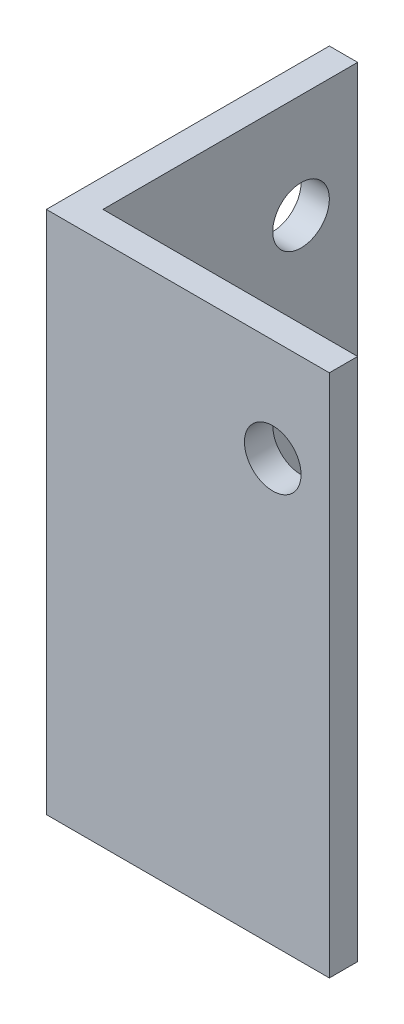
from build123d import *

# Parameters (mm, degrees)
BOSS_EXTRUDE1_DEPTH = 21
SKETCH2_R           = 1
CUT_EXTRUDE1_DEPTH  = 21
CUT_EXTRUDE2_DEPTH  = 2.48
SKETCH4_R           = 1
CUT_EXTRUDE3_DEPTH  = 2.48


with BuildPart() as part:
    # Sketch1 → Boss-Extrude1 (new body)
    with BuildSketch(Plane(origin=(0, 0, 0), x_dir=(1, 0, 0), z_dir=(0, 1, 0))):
        Polygon((0, 0), (0, 10), (1, 10), (1, 1), (10, 1), (10, 0), align=None)
    extrude(amount=BOSS_EXTRUDE1_DEPTH)

    # Sketch2 → Cut-Extrude1 (cut)
    with BuildSketch(Plane(origin=(0, 0, -1), x_dir=(-1, 0, 0), z_dir=(0, 0, -1))):
        with Locations((-8, 17.381971211)):
            Circle(SKETCH2_R)
    extrude(amount=-CUT_EXTRUDE1_DEPTH, mode=Mode.SUBTRACT)

    # Sketch3 → Cut-Extrude2 (cut)
    with BuildSketch(Plane.XZ):
        Polygon((10, 0), (10, -1), (1, -1), (1, -10), (0, -10), (0, 0), align=None)
    extrude(amount=-CUT_EXTRUDE2_DEPTH, mode=Mode.SUBTRACT)

    # Sketch4 → Cut-Extrude3 (cut)
    with BuildSketch(Plane(origin=(1, 0, 0), x_dir=(0, 0, -1), z_dir=(1, 0, 0))):
        with Locations((8, 17.32)):
            Circle(SKETCH4_R)
    extrude(amount=-CUT_EXTRUDE3_DEPTH, mode=Mode.SUBTRACT)


solid = part.part
